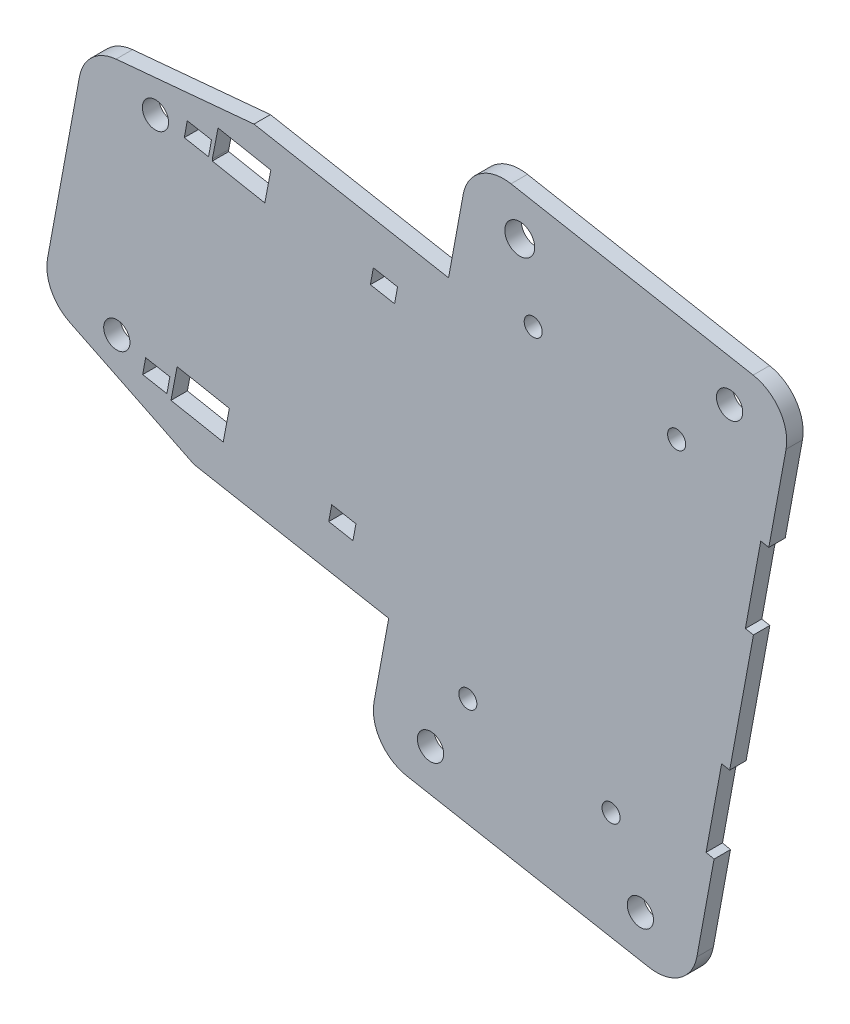
from build123d import *

# Parameters (mm, degrees)
SKETCH1_R           = 1.6
SKETCH1_R_2         = 1.821636576
BOSS_EXTRUDE1_DEPTH = 2
CUT_EXTRUDE1_DEPTH  = 2
CUT_EXTRUDE2_REACH  = 91.979
SKETCH3_R           = 1.1


with BuildPart() as part:
    # Sketch1 → Boss-Extrude1 (new body)
    with BuildSketch(Plane.XY):
        with BuildLine():
            Line((-1.061078705, 5.279593922), (28.442500971, -0.155365716))
            ThreePointArc((28.442500971, -0.155365716), (31.654220711, -2.236114921), (32.453937644, -5.978455602))
            Line((32.453937644, -5.978455602), (21.584018369, -64.985614955))
            ThreePointArc((21.584018369, -64.985614955), (19.503269163, -68.197334694), (15.760928483, -68.997051628))
            Line((15.760928483, -68.997051628), (-13.742651194, -63.56209199))
            ThreePointArc((-13.742651194, -63.56209199), (-16.954370933, -61.481342785), (-17.754087867, -57.739002104))
            Line((-17.754087867, -57.739002104), (-15.96422722, -48.022776093))
            Line((-15.96422722, -48.022776093), (-39.673587654, -43.655190247))
            Line((-39.673587654, -43.655190247), (-52.939586595, -37.150402745))
            Line((-52.939586595, -37.150402745), (-54.821863672, -36.227455859))
            ThreePointArc((-54.821863672, -36.227455859), (-57.086606666, -33.986331814), (-57.537836973, -30.832272681))
            Line((-57.537836973, -30.832272681), (-53.644253203, -9.696023904))
            ThreePointArc((-53.644253203, -9.696023904), (-52.098740676, -6.909791889), (-49.184068361, -5.622786411))
            Line((-49.184068361, -5.622786411), (-47.096468931, -5.431144635))
            Line((-47.096468931, -5.431144635), (-32.383389672, -4.080482917))
            Line((-32.383389672, -4.080482917), (-8.674029238, -8.448068762))
            Line((-8.674029238, -8.448068762), (-6.884168591, 1.268157249))
            ThreePointArc((-6.884168591, 1.268157249), (-4.803419386, 4.479876988), (-1.061078705, 5.279593922))
        make_face()
        with Locations((-44.384822009, -9.109751657)):
            Circle(SKETCH1_R, mode=Mode.SUBTRACT)
        with Locations((-49.095120362, -34.67952071)):
            Circle(SKETCH1_R, mode=Mode.SUBTRACT)
        with Locations((-10.869919276, -59.007159353)):
            Circle(SKETCH1_R, mode=Mode.SUBTRACT)
        with Locations((14.699849777, -63.717457706)):
            Circle(SKETCH1_R, mode=Mode.SUBTRACT)
        Circle(SKETCH1_R_2, mode=Mode.SUBTRACT)
        with Locations((25.569769053, -4.710298353)):
            Circle(SKETCH1_R, mode=Mode.SUBTRACT)
        Polygon((-42.496595483, -38.291112185), (-41.746841807, -34.362402924), (-35.380415499, -35.577369777), (-36.130169175, -39.506079038), align=None, mode=Mode.SUBTRACT)
        Polygon((-37.458250782, -10.313833259), (-36.76371904, -6.674486931), (-30.329701085, -7.902352953), (-31.062719564, -11.743369783), (-37.458250782, -10.522848558), align=None, mode=Mode.SUBTRACT)
    extrude(amount=BOSS_EXTRUDE1_DEPTH)

    # Sketch2 → Cut-Extrude1 (cut)
    with BuildSketch(Plane.XY.offset(2)):
        Polygon((-42.631536652, -35.870200518), (-45.58189462, -35.326704554), (-45.944225262, -37.293609866), (-42.993867295, -37.83710583), align=None)
        Polygon((-40.509265624, -7.790030189), (-37.558907657, -8.333526153), (-37.921238299, -10.300431465), (-40.871596267, -9.756935501), align=None)
        Polygon((-22.908632922, -39.503426957), (-19.958274954, -40.04692292), (-20.320605596, -42.013828232), (-23.270963564, -41.470332268), align=None)
        Polygon((-17.836003926, -11.966752592), (-14.885645959, -12.510248555), (-15.247976601, -14.477153867), (-18.198334569, -13.933657903), align=None)
    extrude(amount=-CUT_EXTRUDE1_DEPTH, mode=Mode.SUBTRACT)

    # Sketch3 → Cut-Extrude2 (cut, up to next)
    with BuildSketch(Plane.XY.offset(2), mode=Mode.PRIVATE) as cut_extrude2_sk1:
        with Locations((-6.322810567, -51.696321435)):
            Circle(SKETCH3_R)
    cut_extrude2_tool1 = extrude(cut_extrude2_sk1.sketch, amount=-CUT_EXTRUDE2_REACH, mode=Mode.PRIVATE) & part.part
    # Sketch3 → Cut-Extrude2 (cut, up to next)
    with BuildSketch(Plane.XY.offset(2), mode=Mode.PRIVATE) as cut_extrude2_sk2:
        with Locations((11.126928282, -54.98634737)):
            Circle(SKETCH3_R)
    cut_extrude2_tool2 = extrude(cut_extrude2_sk2.sketch, amount=-CUT_EXTRUDE2_REACH, mode=Mode.PRIVATE) & part.part
    # Sketch3 → Cut-Extrude2 (cut, up to next)
    with BuildSketch(Plane.XY.offset(2), mode=Mode.PRIVATE) as cut_extrude2_sk3:
        with Locations(Location((19.120179881, -11.595126253, 0), (0, 0, 180))):
            Circle(SKETCH3_R)
    cut_extrude2_tool3 = extrude(cut_extrude2_sk3.sketch, amount=-CUT_EXTRUDE2_REACH, mode=Mode.PRIVATE) & part.part
    # Sketch3 → Cut-Extrude2 (cut, up to next)
    with BuildSketch(Plane.XY.offset(2), mode=Mode.PRIVATE) as cut_extrude2_sk4:
        with Locations(Location((1.64352088, -8.451235874, 0), (0, 0, 180))):
            Circle(SKETCH3_R)
    cut_extrude2_tool4 = extrude(cut_extrude2_sk4.sketch, amount=-CUT_EXTRUDE2_REACH, mode=Mode.PRIVATE) & part.part
    # Sketch3 → Cut-Extrude2 (cut, up to next)
    with BuildSketch(Plane.XY.offset(2), mode=Mode.PRIVATE) as cut_extrude2_sk5:
        Polygon((22.704393125, -53.387885203), (24.600919852, -43.088599847), (25.584372508, -43.269765168), (23.680211994, -53.606465934), align=None)
    cut_extrude2_tool5 = extrude(cut_extrude2_sk5.sketch, amount=-CUT_EXTRUDE2_REACH, mode=Mode.PRIVATE) & part.part
    # Sketch3 → Cut-Extrude2 (cut, up to next)
    with BuildSketch(Plane.XY.offset(2), mode=Mode.PRIVATE) as cut_extrude2_sk6:
        Polygon((28.479203416, -27.555228163), (27.49575076, -27.374062842), (29.36883744, -17.206045825), (30.352290096, -17.387211146), align=None)
    cut_extrude2_tool6 = extrude(cut_extrude2_sk6.sketch, amount=-CUT_EXTRUDE2_REACH, mode=Mode.PRIVATE) & part.part
    add(cut_extrude2_tool1.solids().sort_by_distance((-6.322811, -51.696321, 2))[0], mode=Mode.SUBTRACT)
    add(cut_extrude2_tool2.solids().sort_by_distance((11.126928, -54.986347, 2))[0], mode=Mode.SUBTRACT)
    add(cut_extrude2_tool3.solids().sort_by_distance((19.12018, -11.595126, 2))[0], mode=Mode.SUBTRACT)
    add(cut_extrude2_tool4.solids().sort_by_distance((1.643521, -8.451236, 2))[0], mode=Mode.SUBTRACT)
    add(cut_extrude2_tool5.solids().sort_by_distance((24.142887, -48.337611, 2))[0], mode=Mode.SUBTRACT)
    add(cut_extrude2_tool6.solids().sort_by_distance((28.92402, -22.380637, 2))[0], mode=Mode.SUBTRACT)


solid = part.part
